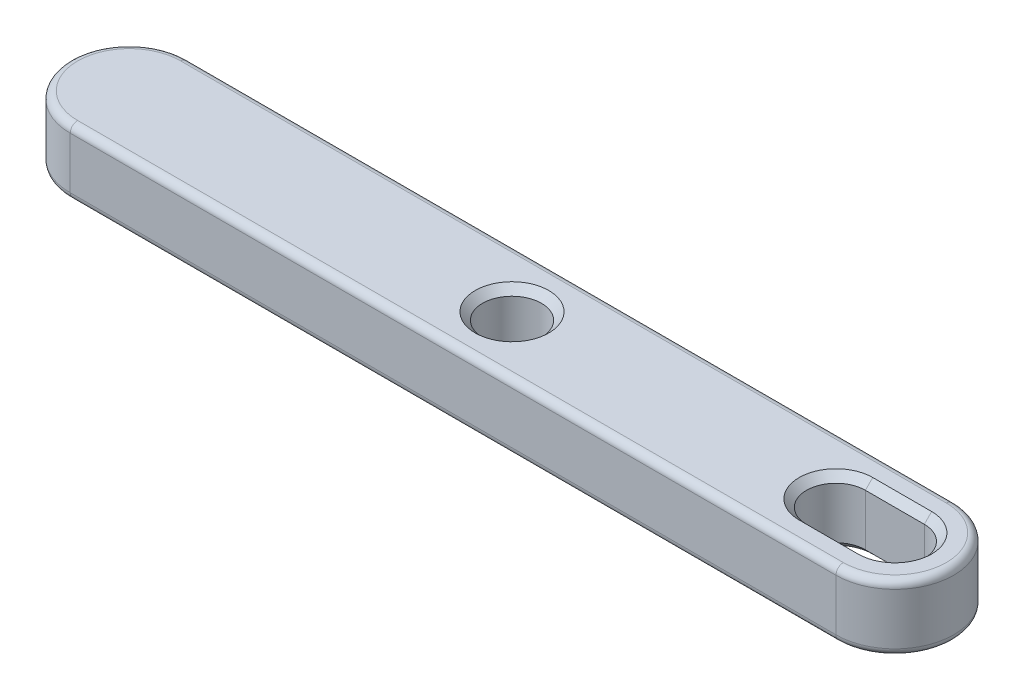
from build123d import *

# Parameters (mm, degrees)
ESBO_O1_R                = 2
RESSALTO_EXTRUS_O1_DEPTH = 2.25
CHANFRO1_SIZE            = 0.5
FILETE1_R                = 0.5


with BuildPart() as part:
    # Esboço1 → Ressalto-extrusão1 (new, symmetric)
    with BuildSketch(Plane(origin=(0, 0, 0), x_dir=(1, 0, 0), z_dir=(0, 1, 0))):
        with BuildLine():
            Line((-26, 4), (26, 4))
            ThreePointArc((26, 4), (30, 0), (26, -4))
            Line((26, -4), (-26, -4))
            ThreePointArc((-26, -4), (-30, 0), (-26, 4))
        make_face()
        with Locations(Location((0, 0, 0), (0, 0, 270))):
            Circle(ESBO_O1_R, mode=Mode.SUBTRACT)
        with BuildLine():
            Line((26, -2), (22, -2))
            ThreePointArc((22, -2), (20, 0), (22, 2))
            Line((22, 2), (26, 2))
            ThreePointArc((26, 2), (28, 0), (26, -2))
        make_face(mode=Mode.SUBTRACT)
    extrude(amount=RESSALTO_EXTRUS_O1_DEPTH, both=True)

    # Chanfro1
    chanfro1_edges = [part.edges().sort_by_distance(p)[0] for p in [
        (0, -2.25, -2),
        (0, 2.25, -2),
        (28, -2.25, 0),
        (24, -2.25, -2),
        (20, -2.25, 0),
        (24, -2.25, 2),
        (28, 2.25, 0),
        (24, 2.25, -2),
        (20, 2.25, 0),
        (24, 2.25, 2),
    ]]
    chamfer(chanfro1_edges, length=CHANFRO1_SIZE)

    # Filete1
    filete1_edges = [part.edges().sort_by_distance(p)[0] for p in [
        (30, 2.25, 0),
        (0, 2.25, -4),
        (-30, 2.25, 0),
        (0, -2.25, -4),
        (30, -2.25, 0),
        (0, -2.25, 4),
        (-30, -2.25, 0),
        (0, 2.25, 4),
    ]]
    fillet(filete1_edges, radius=FILETE1_R)


solid = part.part
